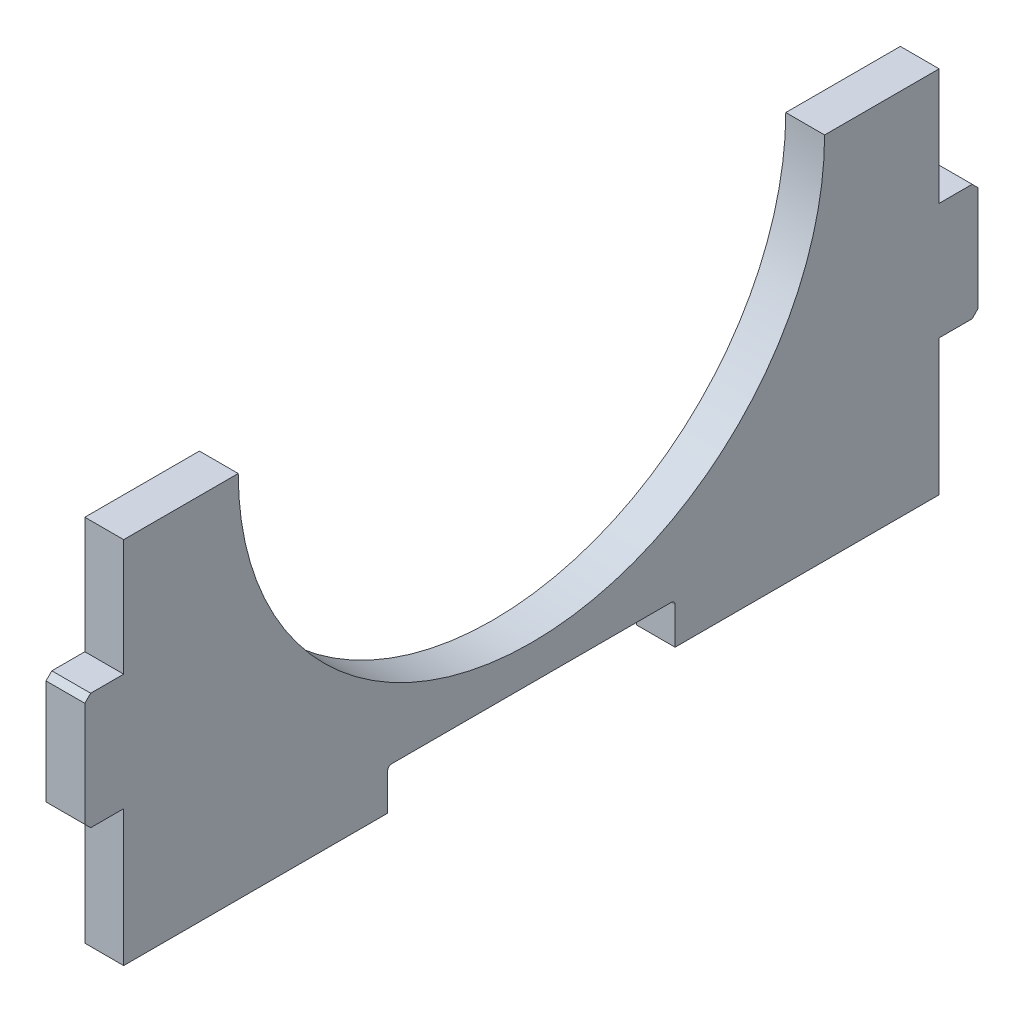
from build123d import *

# Parameters (mm, degrees)
EXTRUDE_754_DEPTH              = 5
SKETCH_2_W                     = 10
SKETCH_2_H                     = 30
EXTRUDE_813_DEPTH              = 5
CHAMFER_861_SIZE               = 1.5
CHAMFER_861_OF_MIRROR_928_SIZE = 1.5
CUT_EXTRUDE_956_DEPTH          = 150.248115566
CUT_EXTRUDE_956_DEPTH_BACK     = 150.248115566
SKETCH_3_W                     = 74
SKETCH_3_H                     = 10.5
FILLET_R_R                     = 1


with BuildPart() as part:
    # ｽｹｯﾁ1 → Extrude 754 (new, symmetric)
    with BuildSketch(Plane(origin=(0, 0, 0), x_dir=(0, 0, -1), z_dir=(1, 0, 0))):
        with BuildLine():
            Line((75.5, 0), (105, 0))
            Line((105, 0), (105, -95))
            Line((105, -95), (-105, -95))
            Line((-105, -95), (-105, 0))
            Line((-105, 0), (-75.5, 0))
            ThreePointArc((-75.5, 0), (0, -75.5), (75.5, 0))
        make_face()
    extrude(amount=EXTRUDE_754_DEPTH, both=True)

    # ｽｹｯﾁ2 → Extrude 813 (add, symmetric)
    with BuildSketch(Plane(origin=(0, 0, 0), x_dir=(0, 0, -1), z_dir=(1, 0, 0))):
        with Locations((-110, -45)):
            Rectangle(SKETCH_2_W, SKETCH_2_H)
    extrude_813 = extrude(amount=EXTRUDE_813_DEPTH, both=True)

    # Chamfer 861
    chamfer_861_edges = [part.edges().sort_by_distance(p)[0] for p in [
        (0, -30, 115),
        (0, -60, 115),
    ]]
    chamfer(chamfer_861_edges, length=CHAMFER_861_SIZE)

    # Mirror 928: Extrude 813 across plane
    add(extrude_813.mirror(Plane.XY))

    # Chamfer 861 of Mirror 928
    chamfer_861_of_mirror_928_edges = [part.edges().sort_by_distance(p)[0] for p in [
        (0, -30, -115),
        (0, -60, -115),
    ]]
    chamfer(chamfer_861_of_mirror_928_edges, length=CHAMFER_861_OF_MIRROR_928_SIZE)

    # ｽｹｯﾁ3 → Cut-Extrude 956 (cut, two sides: drawn at the far end of the back side and taken through both)
    with BuildSketch(Plane(origin=(0, 0, 0), x_dir=(0, 0, -1), z_dir=(1, 0, 0)).offset(-CUT_EXTRUDE_956_DEPTH_BACK)):
        with Locations((0, -89.75)):
            Rectangle(SKETCH_3_W, SKETCH_3_H)
    extrude(amount=CUT_EXTRUDE_956_DEPTH + CUT_EXTRUDE_956_DEPTH_BACK, mode=Mode.SUBTRACT)

    # くぐり穴 内角R
    fillet_r_edges = [part.edges().sort_by_distance(p)[0] for p in [
        (0, -84.5, -37),
        (0, -84.5, 37),
    ]]
    fillet(fillet_r_edges, radius=FILLET_R_R)


solid = part.part
